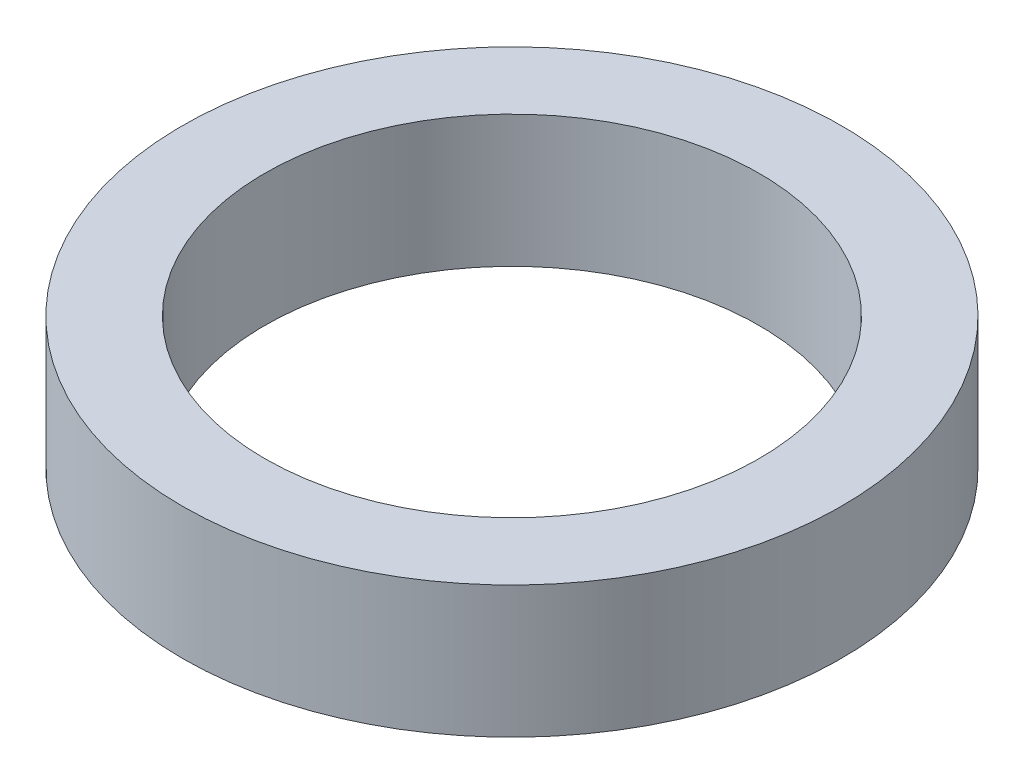
from build123d import *

# Parameters (mm, degrees)
SKETCH1_R           = 6.35
SKETCH1_R_2         = 4.7625
BOSS_EXTRUDE1_DEPTH = 2.54


with BuildPart() as part:
    # Sketch1 → Boss-Extrude1 (new body)
    with BuildSketch(Plane(origin=(0, 0, 0), x_dir=(1, 0, 0), z_dir=(0, 1, 0))):
        with Locations(Location((0, 0, 0), (0, 0, 270))):
            Circle(SKETCH1_R)
        with Locations(Location((0, 0, 0), (0, 0, 270))):
            Circle(SKETCH1_R_2, mode=Mode.SUBTRACT)
    extrude(amount=BOSS_EXTRUDE1_DEPTH)


solid = part.part
